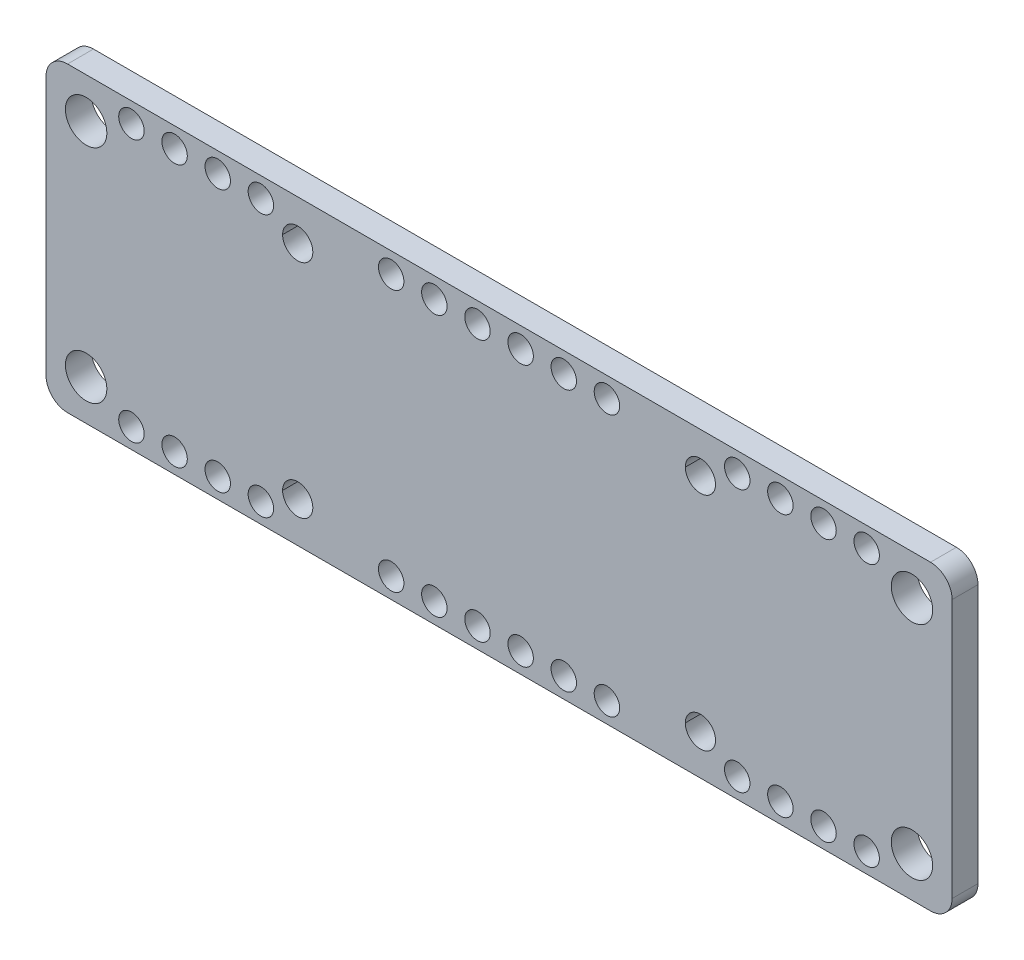
from build123d import *

# Parameters (mm, degrees)
SKETCH2_W               = 53.34
SKETCH2_H               = 17.780149528
BOSS_EXTRUDE1_DEPTH     = 1.524
CUT_EXTRUDE1_REACH      = 30.154
F_2_CLEARANCE_HOLE1_D   = 2.4384
CUT_EXTRUDE2_REACH      = 30.154
SKETCH6_R               = 0.7493
LPATTERN1_COUNT         = 4
LPATTERN1_PITCH         = 2.54
MIRROR1_COPY_1_REACH    = 30.154
MIRROR1_COPY_1_SKETCH_R = 0.7493
MIRROR1_COPY_2_REACH    = 30.154
MIRROR1_COPY_2_SKETCH_R = 0.7493
MIRROR1_COPY_3_REACH    = 30.154
MIRROR1_COPY_3_SKETCH_R = 0.7493
MIRROR2_COPY_1_REACH    = 30.154
MIRROR2_COPY_1_SKETCH_R = 0.7493
MIRROR2_COPY_2_REACH    = 30.154
MIRROR2_COPY_2_SKETCH_R = 0.7493
MIRROR2_COPY_3_REACH    = 30.154
MIRROR2_COPY_3_SKETCH_R = 0.7493
MIRROR2_COPY_4_REACH    = 30.154
MIRROR2_COPY_4_SKETCH_R = 0.7493
MIRROR2_COPY_5_REACH    = 30.154
MIRROR2_COPY_5_SKETCH_R = 0.7493
MIRROR2_COPY_6_REACH    = 30.154
MIRROR2_COPY_6_SKETCH_R = 0.7493
MIRROR2_COPY_7_REACH    = 30.154
MIRROR2_COPY_7_SKETCH_R = 0.7493
FILLET1_R               = 1.27
CUT_EXTRUDE3_REACH      = 30.154
SKETCH7_R               = 0.7493
LPATTERN2_COUNT         = 6
LPATTERN2_PITCH         = 2.54
MIRROR3_COPY_1_REACH    = 30.154
MIRROR3_COPY_1_SKETCH_R = 0.7493
MIRROR3_COPY_2_REACH    = 30.154
MIRROR3_COPY_2_SKETCH_R = 0.7493
MIRROR3_COPY_3_REACH    = 30.154
MIRROR3_COPY_3_SKETCH_R = 0.7493
MIRROR3_COPY_4_REACH    = 30.154
MIRROR3_COPY_4_SKETCH_R = 0.7493
MIRROR3_COPY_5_REACH    = 30.154
MIRROR3_COPY_5_SKETCH_R = 0.7493


with BuildPart() as part:
    # Sketch2 → Boss-Extrude1 (new body)
    with BuildSketch(Plane.XY):
        Rectangle(SKETCH2_W, SKETCH2_H)
    extrude(amount=-BOSS_EXTRUDE1_DEPTH)

    # Sketch3 → Cut-Extrude1 (cut, up to next)
    with BuildSketch(Plane.XY, mode=Mode.PRIVATE) as cut_extrude1_sk1:
        with BuildLine():
            add(Edge.make_bspline(
                [(-10.964023615, 6.519330742), (-10.964023615, 7.010084918), (-11.361932406, 7.407993709), (-11.853203346, 7.407993709), (-12.344129777, 7.407993709), (-12.742038568, 7.010084918), (-12.742038568, 6.519330742)],
                knots=[0, 0, 0, 0, 1, 1, 1, 2, 2, 2, 2], degree=3))
            add(Edge.make_bspline(
                [(-12.742038568, 6.519330742), (-12.742038568, 6.028232057), (-12.344129777, 5.630323266), (-11.853203346, 5.630323266), (-11.361932406, 5.630323266), (-10.964023615, 6.028232057), (-10.964023615, 6.519330742)],
                knots=[2, 2, 2, 2, 3, 3, 3, 4, 4, 4, 4], degree=3))
        make_face()
    cut_extrude1_tool1 = extrude(cut_extrude1_sk1.sketch, amount=-CUT_EXTRUDE1_REACH, mode=Mode.PRIVATE) & part.part
    # Sketch3 → Cut-Extrude1 (cut, up to next)
    with BuildSketch(Plane.XY, mode=Mode.PRIVATE) as cut_extrude1_sk2:
        with BuildLine():
            add(Edge.make_bspline(
                [(-10.964023615, -6.519158487), (-10.964023615, -6.028576567), (-11.361932406, -5.630667776), (-11.853203346, -5.630667776), (-12.344129777, -5.630667776), (-12.742038568, -6.028576567), (-12.742038568, -6.519158487)],
                knots=[0, 0, 0, 0, 1, 1, 1, 2, 2, 2, 2], degree=3))
            add(Edge.make_bspline(
                [(-12.742038568, -6.519158487), (-12.742038568, -7.010429428), (-12.344129777, -7.408338219), (-11.853203346, -7.408338219), (-11.361932406, -7.408338219), (-10.964023615, -7.010429428), (-10.964023615, -6.519158487)],
                knots=[2, 2, 2, 2, 3, 3, 3, 4, 4, 4, 4], degree=3))
        make_face()
    cut_extrude1_tool2 = extrude(cut_extrude1_sk2.sketch, amount=-CUT_EXTRUDE1_REACH, mode=Mode.PRIVATE) & part.part
    # Sketch3 → Cut-Extrude1 (cut, up to next)
    with BuildSketch(Plane.XY, mode=Mode.PRIVATE) as cut_extrude1_sk3:
        with BuildLine():
            add(Edge.make_bspline(
                [(12.742383077, -6.519158487), (12.742383077, -6.028576567), (12.344474286, -5.630667776), (11.853547856, -5.630667776), (11.362621425, -5.630667776), (10.964368124, -6.028576567), (10.964368124, -6.519158487)],
                knots=[0, 0, 0, 0, 1, 1, 1, 2, 2, 2, 2], degree=3))
            add(Edge.make_bspline(
                [(10.964368124, -6.519158487), (10.964368124, -7.010429428), (11.362621425, -7.408338219), (11.853547856, -7.408338219), (12.344474286, -7.408338219), (12.742383077, -7.010429428), (12.742383077, -6.519158487)],
                knots=[2, 2, 2, 2, 3, 3, 3, 4, 4, 4, 4], degree=3))
        make_face()
    cut_extrude1_tool3 = extrude(cut_extrude1_sk3.sketch, amount=-CUT_EXTRUDE1_REACH, mode=Mode.PRIVATE) & part.part
    # Sketch3 → Cut-Extrude1 (cut, up to next)
    with BuildSketch(Plane.XY, mode=Mode.PRIVATE) as cut_extrude1_sk4:
        with BuildLine():
            add(Edge.make_bspline(
                [(12.742383077, 6.519330742), (12.742383077, 7.010084918), (12.344474286, 7.407993709), (11.853547856, 7.407993709), (11.362621425, 7.407993709), (10.964368124, 7.010084918), (10.964368124, 6.519330742)],
                knots=[0, 0, 0, 0, 1, 1, 1, 2, 2, 2, 2], degree=3))
            add(Edge.make_bspline(
                [(10.964368124, 6.519330742), (10.964368124, 6.028232057), (11.362621425, 5.630323266), (11.853547856, 5.630323266), (12.344474286, 5.630323266), (12.742383077, 6.028232057), (12.742383077, 6.519330742)],
                knots=[2, 2, 2, 2, 3, 3, 3, 4, 4, 4, 4], degree=3))
        make_face()
    cut_extrude1_tool4 = extrude(cut_extrude1_sk4.sketch, amount=-CUT_EXTRUDE1_REACH, mode=Mode.PRIVATE) & part.part
    add(cut_extrude1_tool1.solids().sort_by_distance((-11.853043, 6.51917, 0))[0], mode=Mode.SUBTRACT)
    add(cut_extrude1_tool2.solids().sort_by_distance((-11.853043, -6.519479, 0))[0], mode=Mode.SUBTRACT)
    add(cut_extrude1_tool3.solids().sort_by_distance((11.853419, -6.519479, 0))[0], mode=Mode.SUBTRACT)
    add(cut_extrude1_tool4.solids().sort_by_distance((11.853419, 6.51917, 0))[0], mode=Mode.SUBTRACT)

    # #2 Clearance Hole1 (through all)
    with Locations(Plane.XY):
        with Locations((-24.307679783, 6.519330742), (-24.307679783, -6.519330742), (24.307679783, -6.519330742), (24.307679783, 6.519330742)):
            Hole(F_2_CLEARANCE_HOLE1_D / 2)

    # Sketch6 → Cut-Extrude2 (cut, up to next)
    with BuildSketch(Plane.XY, mode=Mode.PRIVATE) as cut_extrude2_sk1:
        with Locations((-14.0208, 7.7216)):
            Circle(SKETCH6_R)
    cut_extrude2_tool1 = extrude(cut_extrude2_sk1.sketch, amount=-CUT_EXTRUDE2_REACH, mode=Mode.PRIVATE) & part.part
    cut_extrude2 = cut_extrude2_tool1.solids().sort_by_distance((-14.0208, 7.7216, 0))[0]
    add(cut_extrude2, mode=Mode.SUBTRACT)

    # LPattern1: Cut-Extrude2 ×4
    with Locations(*[(-i * LPATTERN1_PITCH, 0, 0) for i in range(1, LPATTERN1_COUNT)]):
        add(cut_extrude2, mode=Mode.SUBTRACT)

    # Mirror1: Cut-Extrude2 across plane
    add(cut_extrude2.mirror(Plane(origin=(0, 0, 0), x_dir=(0, 0, 1), z_dir=(1, 0, 0))), mode=Mode.SUBTRACT)

    # Mirror1 copy 1 sketch → Mirror1 copy 1 (cut, up to next)
    with BuildSketch(Plane(origin=(2.54, 0, 0), x_dir=(-1, 0, 0), z_dir=(0, 0, 1)), mode=Mode.PRIVATE) as mirror1_copy_1_sk1:
        with Locations((-14.0208, -7.7216)):
            Circle(MIRROR1_COPY_1_SKETCH_R)
    mirror1_copy_1_tool1 = extrude(mirror1_copy_1_sk1.sketch, amount=-MIRROR1_COPY_1_REACH, mode=Mode.PRIVATE) & part.part
    add(mirror1_copy_1_tool1.solids().sort_by_distance((16.5608, 7.7216, 0))[0], mode=Mode.SUBTRACT)

    # Mirror1 copy 2 sketch → Mirror1 copy 2 (cut, up to next)
    with BuildSketch(Plane(origin=(5.08, 0, 0), x_dir=(-1, 0, 0), z_dir=(0, 0, 1)), mode=Mode.PRIVATE) as mirror1_copy_2_sk1:
        with Locations((-14.0208, -7.7216)):
            Circle(MIRROR1_COPY_2_SKETCH_R)
    mirror1_copy_2_tool1 = extrude(mirror1_copy_2_sk1.sketch, amount=-MIRROR1_COPY_2_REACH, mode=Mode.PRIVATE) & part.part
    add(mirror1_copy_2_tool1.solids().sort_by_distance((19.1008, 7.7216, 0))[0], mode=Mode.SUBTRACT)

    # Mirror1 copy 3 sketch → Mirror1 copy 3 (cut, up to next)
    with BuildSketch(Plane(origin=(7.62, 0, 0), x_dir=(-1, 0, 0), z_dir=(0, 0, 1)), mode=Mode.PRIVATE) as mirror1_copy_3_sk1:
        with Locations((-14.0208, -7.7216)):
            Circle(MIRROR1_COPY_3_SKETCH_R)
    mirror1_copy_3_tool1 = extrude(mirror1_copy_3_sk1.sketch, amount=-MIRROR1_COPY_3_REACH, mode=Mode.PRIVATE) & part.part
    add(mirror1_copy_3_tool1.solids().sort_by_distance((21.6408, 7.7216, 0))[0], mode=Mode.SUBTRACT)

    # Mirror2: Cut-Extrude2 across plane
    add(cut_extrude2.mirror(Plane.ZX), mode=Mode.SUBTRACT)

    # Mirror2 copy 1 sketch → Mirror2 copy 1 (cut, up to next)
    with BuildSketch(Plane(origin=(-2.54, 0, 0), x_dir=(1, 0, 0), z_dir=(0, 0, 1)), mode=Mode.PRIVATE) as mirror2_copy_1_sk1:
        with Locations((-14.0208, -7.7216)):
            Circle(MIRROR2_COPY_1_SKETCH_R)
    mirror2_copy_1_tool1 = extrude(mirror2_copy_1_sk1.sketch, amount=-MIRROR2_COPY_1_REACH, mode=Mode.PRIVATE) & part.part
    add(mirror2_copy_1_tool1.solids().sort_by_distance((-16.5608, -7.7216, 0))[0], mode=Mode.SUBTRACT)

    # Mirror2 copy 2 sketch → Mirror2 copy 2 (cut, up to next)
    with BuildSketch(Plane(origin=(-5.08, 0, 0), x_dir=(1, 0, 0), z_dir=(0, 0, 1)), mode=Mode.PRIVATE) as mirror2_copy_2_sk1:
        with Locations((-14.0208, -7.7216)):
            Circle(MIRROR2_COPY_2_SKETCH_R)
    mirror2_copy_2_tool1 = extrude(mirror2_copy_2_sk1.sketch, amount=-MIRROR2_COPY_2_REACH, mode=Mode.PRIVATE) & part.part
    add(mirror2_copy_2_tool1.solids().sort_by_distance((-19.1008, -7.7216, 0))[0], mode=Mode.SUBTRACT)

    # Mirror2 copy 3 sketch → Mirror2 copy 3 (cut, up to next)
    with BuildSketch(Plane(origin=(-7.62, 0, 0), x_dir=(1, 0, 0), z_dir=(0, 0, 1)), mode=Mode.PRIVATE) as mirror2_copy_3_sk1:
        with Locations((-14.0208, -7.7216)):
            Circle(MIRROR2_COPY_3_SKETCH_R)
    mirror2_copy_3_tool1 = extrude(mirror2_copy_3_sk1.sketch, amount=-MIRROR2_COPY_3_REACH, mode=Mode.PRIVATE) & part.part
    add(mirror2_copy_3_tool1.solids().sort_by_distance((-21.6408, -7.7216, 0))[0], mode=Mode.SUBTRACT)

    # Mirror2 copy 4 sketch → Mirror2 copy 4 (cut, up to next)
    with BuildSketch(Plane(origin=(0, 0, 0), x_dir=(-1, 0, 0), z_dir=(0, 0, 1)), mode=Mode.PRIVATE) as mirror2_copy_4_sk1:
        with Locations((-14.0208, 7.7216)):
            Circle(MIRROR2_COPY_4_SKETCH_R)
    mirror2_copy_4_tool1 = extrude(mirror2_copy_4_sk1.sketch, amount=-MIRROR2_COPY_4_REACH, mode=Mode.PRIVATE) & part.part
    add(mirror2_copy_4_tool1.solids().sort_by_distance((14.0208, -7.7216, 0))[0], mode=Mode.SUBTRACT)

    # Mirror2 copy 5 sketch → Mirror2 copy 5 (cut, up to next)
    with BuildSketch(Plane(origin=(2.54, 0, 0), x_dir=(-1, 0, 0), z_dir=(0, 0, 1)), mode=Mode.PRIVATE) as mirror2_copy_5_sk1:
        with Locations((-14.0208, 7.7216)):
            Circle(MIRROR2_COPY_5_SKETCH_R)
    mirror2_copy_5_tool1 = extrude(mirror2_copy_5_sk1.sketch, amount=-MIRROR2_COPY_5_REACH, mode=Mode.PRIVATE) & part.part
    add(mirror2_copy_5_tool1.solids().sort_by_distance((16.5608, -7.7216, 0))[0], mode=Mode.SUBTRACT)

    # Mirror2 copy 6 sketch → Mirror2 copy 6 (cut, up to next)
    with BuildSketch(Plane(origin=(5.08, 0, 0), x_dir=(-1, 0, 0), z_dir=(0, 0, 1)), mode=Mode.PRIVATE) as mirror2_copy_6_sk1:
        with Locations((-14.0208, 7.7216)):
            Circle(MIRROR2_COPY_6_SKETCH_R)
    mirror2_copy_6_tool1 = extrude(mirror2_copy_6_sk1.sketch, amount=-MIRROR2_COPY_6_REACH, mode=Mode.PRIVATE) & part.part
    add(mirror2_copy_6_tool1.solids().sort_by_distance((19.1008, -7.7216, 0))[0], mode=Mode.SUBTRACT)

    # Mirror2 copy 7 sketch → Mirror2 copy 7 (cut, up to next)
    with BuildSketch(Plane(origin=(7.62, 0, 0), x_dir=(-1, 0, 0), z_dir=(0, 0, 1)), mode=Mode.PRIVATE) as mirror2_copy_7_sk1:
        with Locations((-14.0208, 7.7216)):
            Circle(MIRROR2_COPY_7_SKETCH_R)
    mirror2_copy_7_tool1 = extrude(mirror2_copy_7_sk1.sketch, amount=-MIRROR2_COPY_7_REACH, mode=Mode.PRIVATE) & part.part
    add(mirror2_copy_7_tool1.solids().sort_by_distance((21.6408, -7.7216, 0))[0], mode=Mode.SUBTRACT)

    # Fillet1
    fillet1_edges = [part.edges().sort_by_distance(p)[0] for p in [
        (-26.67, 8.890074764, -0.762),
        (26.67, 8.890074764, -0.762),
        (26.67, -8.890074764, -0.762),
        (-26.67, -8.890074764, -0.762),
    ]]
    fillet(fillet1_edges, radius=FILLET1_R)

    # Sketch7 → Cut-Extrude3 (cut, up to next)
    with BuildSketch(Plane.XY, mode=Mode.PRIVATE) as cut_extrude3_sk1:
        with Locations((6.35, 7.6962)):
            Circle(SKETCH7_R)
    cut_extrude3_tool1 = extrude(cut_extrude3_sk1.sketch, amount=-CUT_EXTRUDE3_REACH, mode=Mode.PRIVATE) & part.part
    cut_extrude3 = cut_extrude3_tool1.solids().sort_by_distance((6.35, 7.6962, 0))[0]
    add(cut_extrude3, mode=Mode.SUBTRACT)

    # LPattern2: Cut-Extrude3 ×6
    with Locations(*[(-i * LPATTERN2_PITCH, 0, 0) for i in range(1, LPATTERN2_COUNT)]):
        add(cut_extrude3, mode=Mode.SUBTRACT)

    # Mirror3: Cut-Extrude3 across plane
    add(cut_extrude3.mirror(Plane.ZX), mode=Mode.SUBTRACT)

    # Mirror3 copy 1 sketch → Mirror3 copy 1 (cut, up to next)
    with BuildSketch(Plane(origin=(-2.54, 0, 0), x_dir=(1, 0, 0), z_dir=(0, 0, 1)), mode=Mode.PRIVATE) as mirror3_copy_1_sk1:
        with Locations((6.35, -7.6962)):
            Circle(MIRROR3_COPY_1_SKETCH_R)
    mirror3_copy_1_tool1 = extrude(mirror3_copy_1_sk1.sketch, amount=-MIRROR3_COPY_1_REACH, mode=Mode.PRIVATE) & part.part
    add(mirror3_copy_1_tool1.solids().sort_by_distance((3.81, -7.6962, 0))[0], mode=Mode.SUBTRACT)

    # Mirror3 copy 2 sketch → Mirror3 copy 2 (cut, up to next)
    with BuildSketch(Plane(origin=(-5.08, 0, 0), x_dir=(1, 0, 0), z_dir=(0, 0, 1)), mode=Mode.PRIVATE) as mirror3_copy_2_sk1:
        with Locations((6.35, -7.6962)):
            Circle(MIRROR3_COPY_2_SKETCH_R)
    mirror3_copy_2_tool1 = extrude(mirror3_copy_2_sk1.sketch, amount=-MIRROR3_COPY_2_REACH, mode=Mode.PRIVATE) & part.part
    add(mirror3_copy_2_tool1.solids().sort_by_distance((1.27, -7.6962, 0))[0], mode=Mode.SUBTRACT)

    # Mirror3 copy 3 sketch → Mirror3 copy 3 (cut, up to next)
    with BuildSketch(Plane(origin=(-7.62, 0, 0), x_dir=(1, 0, 0), z_dir=(0, 0, 1)), mode=Mode.PRIVATE) as mirror3_copy_3_sk1:
        with Locations((6.35, -7.6962)):
            Circle(MIRROR3_COPY_3_SKETCH_R)
    mirror3_copy_3_tool1 = extrude(mirror3_copy_3_sk1.sketch, amount=-MIRROR3_COPY_3_REACH, mode=Mode.PRIVATE) & part.part
    add(mirror3_copy_3_tool1.solids().sort_by_distance((-1.27, -7.6962, 0))[0], mode=Mode.SUBTRACT)

    # Mirror3 copy 4 sketch → Mirror3 copy 4 (cut, up to next)
    with BuildSketch(Plane(origin=(-10.16, 0, 0), x_dir=(1, 0, 0), z_dir=(0, 0, 1)), mode=Mode.PRIVATE) as mirror3_copy_4_sk1:
        with Locations((6.35, -7.6962)):
            Circle(MIRROR3_COPY_4_SKETCH_R)
    mirror3_copy_4_tool1 = extrude(mirror3_copy_4_sk1.sketch, amount=-MIRROR3_COPY_4_REACH, mode=Mode.PRIVATE) & part.part
    add(mirror3_copy_4_tool1.solids().sort_by_distance((-3.81, -7.6962, 0))[0], mode=Mode.SUBTRACT)

    # Mirror3 copy 5 sketch → Mirror3 copy 5 (cut, up to next)
    with BuildSketch(Plane(origin=(-12.7, 0, 0), x_dir=(1, 0, 0), z_dir=(0, 0, 1)), mode=Mode.PRIVATE) as mirror3_copy_5_sk1:
        with Locations((6.35, -7.6962)):
            Circle(MIRROR3_COPY_5_SKETCH_R)
    mirror3_copy_5_tool1 = extrude(mirror3_copy_5_sk1.sketch, amount=-MIRROR3_COPY_5_REACH, mode=Mode.PRIVATE) & part.part
    add(mirror3_copy_5_tool1.solids().sort_by_distance((-6.35, -7.6962, 0))[0], mode=Mode.SUBTRACT)


solid = part.part
